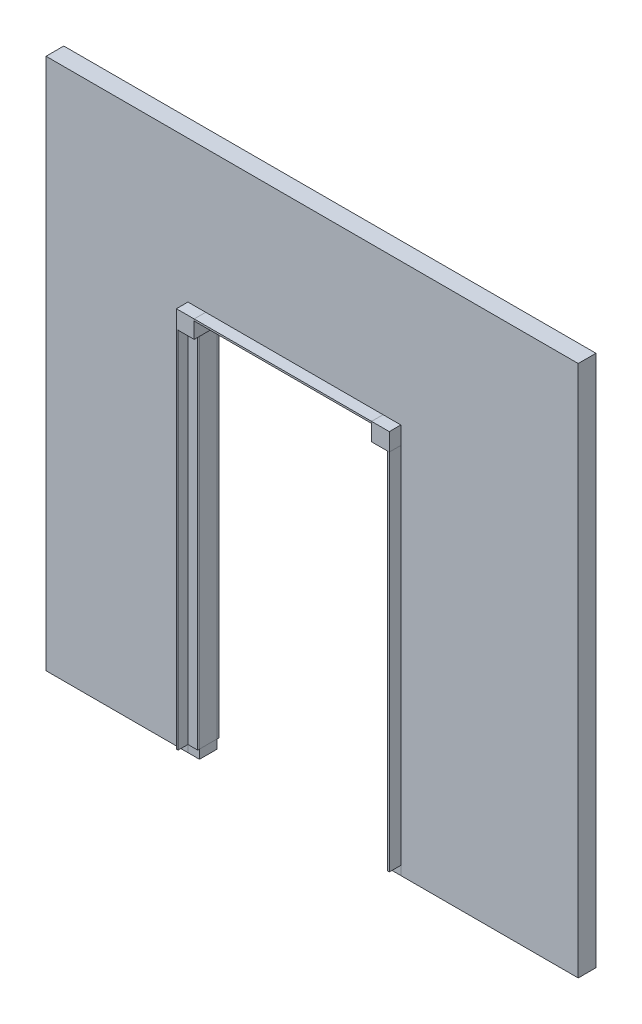
from build123d import *

# Parameters (mm, degrees)
SKETCH1_W                   = 3000
SKETCH1_H                   = 3000
SKETCH1_W_2                 = 1200
SKETCH1_H_2                 = 900
BOSS_EXTRUDE1_DEPTH         = 100
BOSS_EXTRUDE19_DEPTH        = 65
BOSS_EXTRUDE19_DEPTH_BACK   = 165
SKETCH19_W                  = 100
SKETCH19_H                  = 100
BOSS_EXTRUDE19_2_DEPTH      = 65
BOSS_EXTRUDE19_2_DEPTH_BACK = 165
BOSS_EXTRUDE22_DEPTH        = 2050
BOSS_EXTRUDE22_2_DEPTH      = 2050
BOSS_EXTRUDE22_3_DEPTH      = 2050
BOSS_EXTRUDE22_4_DEPTH      = 2050
BOSS_EXTRUDE24_DEPTH        = 1000
BOSS_EXTRUDE24_2_DEPTH      = 1000
SKETCH23_W                  = 65
SKETCH23_H                  = 100
BOSS_EXTRUDE25_DEPTH        = 2050
BOSS_EXTRUDE25_2_DEPTH      = 2050
SKETCH24_W                  = 1200
SKETCH24_H                  = 1300
CUT_EXTRUDE1_DEPTH          = 4246.847971843
SKETCH25_W                  = 65
SKETCH25_H                  = 100
BOSS_EXTRUDE26_DEPTH        = 50
BOSS_EXTRUDE26_2_DEPTH      = 50
SKETCH26_W                  = 100
SKETCH26_H                  = 65
BOSS_EXTRUDE27_DEPTH        = 1000


with BuildPart() as part:
    # Sketch1 → Boss-Extrude1 (new body)
    with BuildSketch(Plane.XY):
        with Locations((-1500, 1500)):
            Rectangle(SKETCH1_W, SKETCH1_H)
        with Locations((-1600, 1750)):
            Rectangle(SKETCH1_W_2, SKETCH1_H_2, mode=Mode.SUBTRACT)
    extrude(amount=BOSS_EXTRUDE1_DEPTH)

    # Sketch24 → Cut-Extrude1 (cut, through all)
    with BuildSketch(Plane.XY.offset(100)):
        with Locations((-1600, 650)):
            Rectangle(SKETCH24_W, SKETCH24_H)
    extrude(amount=-CUT_EXTRUDE1_DEPTH, mode=Mode.SUBTRACT)


with BuildPart() as body_2:
    # Sketch19 → Boss-Extrude19 (new, two sides: drawn at the far end of the back side and taken through both)
    with BuildSketch(Plane.XY.offset(100).offset(-BOSS_EXTRUDE19_DEPTH_BACK)):
        with Locations((-2150, 2150)):
            Rectangle(SKETCH19_W, SKETCH19_H)
    extrude(amount=BOSS_EXTRUDE19_DEPTH + BOSS_EXTRUDE19_DEPTH_BACK)


with BuildPart() as body_3:
    # Sketch19 → Boss-Extrude19 2 (new, two sides: drawn at the far end of the back side and taken through both)
    with BuildSketch(Plane.XY.offset(100).offset(-BOSS_EXTRUDE19_2_DEPTH_BACK)):
        with Locations((-1050, 2150)):
            Rectangle(SKETCH19_W, SKETCH19_H)
    extrude(amount=BOSS_EXTRUDE19_2_DEPTH + BOSS_EXTRUDE19_2_DEPTH_BACK)


with BuildPart() as body_4:
    # Sketch22 → Boss-Extrude22 (new body)
    with BuildSketch(Plane.XZ.offset(-2100)):
        Polygon((-1000, 100), (-1065, 100), (-1065, 110), (-1010, 110), (-1010, 165), (-1000, 165), align=None)
    extrude(amount=BOSS_EXTRUDE22_DEPTH)


with BuildPart() as body_5:
    # Sketch22 → Boss-Extrude22 2 (new body)
    with BuildSketch(Plane.XZ.offset(-2100)):
        Polygon((-2200, 165), (-2200, 100), (-2135, 100), (-2135, 110), (-2190, 110), (-2190, 165), align=None)
    extrude(amount=BOSS_EXTRUDE22_2_DEPTH)


with BuildPart() as body_6:
    # Sketch22 → Boss-Extrude22 3 (new body)
    with BuildSketch(Plane.XZ.offset(-2100)):
        Polygon((-2200, 0), (-2135, 0), (-2135, -10), (-2190, -10), (-2190, -65), (-2200, -65), align=None)
    extrude(amount=BOSS_EXTRUDE22_3_DEPTH)


with BuildPart() as body_7:
    # Sketch22 → Boss-Extrude22 4 (new body)
    with BuildSketch(Plane.XZ.offset(-2100)):
        Polygon((-1000, -65), (-1000, 0), (-1065, 0), (-1065, -10), (-1010, -10), (-1010, -65), align=None)
    extrude(amount=BOSS_EXTRUDE22_4_DEPTH)


with BuildPart() as body_8:
    # Sketch21 → Boss-Extrude24 (new body)
    with BuildSketch(Plane(origin=(-2100, 0, 0), x_dir=(0, 0, -1), z_dir=(1, 0, 0))):
        Polygon((65, 2200), (0, 2200), (0, 2135), (10, 2135), (10, 2190), (65, 2190), align=None)
    extrude(amount=BOSS_EXTRUDE24_DEPTH)


with BuildPart() as body_9:
    # Sketch21 → Boss-Extrude24 2 (new body)
    with BuildSketch(Plane(origin=(-2100, 0, 0), x_dir=(0, 0, -1), z_dir=(1, 0, 0))):
        Polygon((-165, 2200), (-100, 2200), (-100, 2135), (-110, 2135), (-110, 2190), (-165, 2190), align=None)
    extrude(amount=BOSS_EXTRUDE24_2_DEPTH)


with BuildPart() as body_10:
    # Sketch23 → Boss-Extrude25 (new body)
    with BuildSketch(Plane(origin=(0, 2100, 300), x_dir=(1, 0, 0), z_dir=(0, -1, 0))):
        with Locations((-1032.5, -250)):
            Rectangle(SKETCH23_W, SKETCH23_H)
    extrude(amount=BOSS_EXTRUDE25_DEPTH)


with BuildPart() as body_11:
    # Sketch23 → Boss-Extrude25 2 (new body)
    with BuildSketch(Plane(origin=(0, 2100, 300), x_dir=(1, 0, 0), z_dir=(0, -1, 0))):
        with Locations((-2167.5, -250)):
            Rectangle(SKETCH23_W, SKETCH23_H)
    extrude(amount=BOSS_EXTRUDE25_2_DEPTH)


with BuildPart() as body_12:
    # Sketch25 → Boss-Extrude26 (new body)
    with BuildSketch(Plane.XZ.offset(-50)):
        with Locations((-1032.5, 50)):
            Rectangle(SKETCH25_W, SKETCH25_H)
    extrude(amount=BOSS_EXTRUDE26_DEPTH)


with BuildPart() as body_13:
    # Sketch25 → Boss-Extrude26 2 (new body)
    with BuildSketch(Plane.XZ.offset(-50)):
        with Locations((-2167.5, 50)):
            Rectangle(SKETCH25_W, SKETCH25_H)
    extrude(amount=BOSS_EXTRUDE26_2_DEPTH)


with BuildPart() as body_14:
    # Sketch26 → Boss-Extrude27 (new body)
    with BuildSketch(Plane(origin=(-2100, 0, 0), x_dir=(0, 0, -1), z_dir=(1, 0, 0))):
        with Locations((-50, 2167.5)):
            Rectangle(SKETCH26_W, SKETCH26_H)
    extrude(amount=BOSS_EXTRUDE27_DEPTH)


solid = Compound([part.part, body_2.part, body_3.part, body_4.part, body_5.part, body_6.part, body_7.part, body_8.part, body_9.part, body_10.part, body_11.part, body_12.part, body_13.part, body_14.part])
